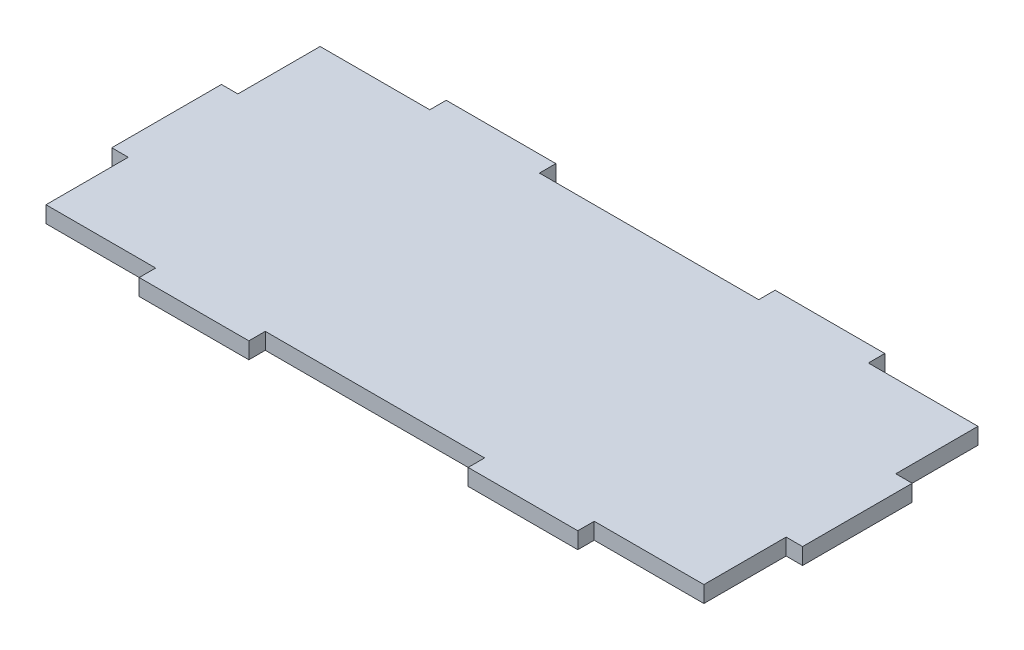
from build123d import *

# Parameters (mm, degrees)
BOSS_EXTRUDE1_DEPTH = 3


with BuildPart() as part:
    # Sketch2 → Boss-Extrude1 (new body)
    with BuildSketch(Plane(origin=(0, 0, 0), x_dir=(1, 0, 0), z_dir=(0, 1, 0))):
        Polygon((0, 0), (20, 0), (20, -3), (40, -3), (40, 0), (80, 0), (80, -3), (100, -3), (100, 0), (120, 0), (120, 15), (123, 15), (123, 35), (120, 35), (120, 50), (100, 50), (100, 53), (80, 53), (80, 50), (40, 50), (40, 53), (20, 53), (20, 50), (0, 50), (0, 35), (-3, 35), (-3, 15), (0, 15), align=None)
    extrude(amount=BOSS_EXTRUDE1_DEPTH)


solid = part.part
